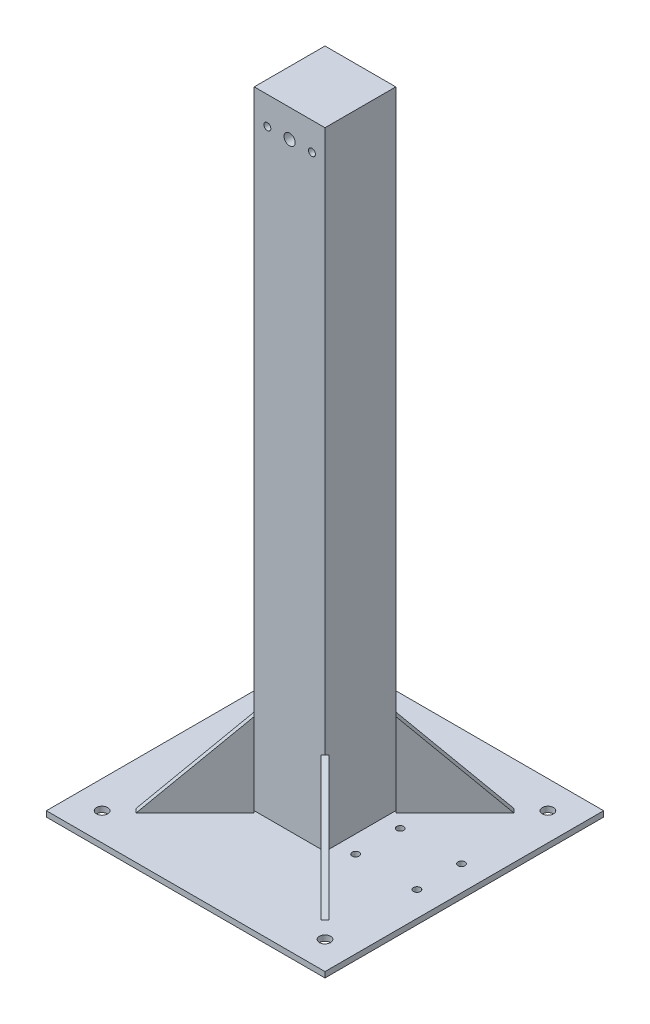
from build123d import *

# Parameters (mm, degrees)
ESBO_O1_W                       = 200
ESBO_O1_H                       = 200
RESSALTO_EXTRUS_O2_DEPTH        = 4
ESBO_O2_W                       = 50.8
ESBO_O2_H                       = 50.8
RESSALTO_EXTRUS_O3_DEPTH        = 450
ESBO_O3_R                       = 4
CORTE_EXTRUS_O1_DEPTH           = 4
CORTE_EXTRUS_O2_DEPTH           = 25.4
CORTE_EXTRUS_O2_DEPTH_BACK      = 25.4
ESBO_O5_R                       = 4
ESBO_O5_R_2                     = 2.5
ESBO_O6_R                       = 2.5
CORTE_EXTRUS_O3_DEPTH           = 4
RESSALTO_EXTRUS_O7_DEPTH        = 2
RESSALTO_EXTRUS_O7_DEPTH_BACK   = 2
RESSALTO_EXTRUS_O7_2_DEPTH      = 2
RESSALTO_EXTRUS_O7_2_DEPTH_BACK = 2
RESSALTO_EXTRUS_O8_DEPTH        = 2
RESSALTO_EXTRUS_O8_DEPTH_BACK   = 2
RESSALTO_EXTRUS_O8_2_DEPTH      = 2
RESSALTO_EXTRUS_O8_2_DEPTH_BACK = 2


with BuildPart() as part:
    # Esboço1 → Ressalto-extrusão2 (new body)
    with BuildSketch(Plane(origin=(0, 0, 0), x_dir=(1, 0, 0), z_dir=(0, 1, 0))):
        Rectangle(ESBO_O1_W, ESBO_O1_H)
    extrude(amount=-RESSALTO_EXTRUS_O2_DEPTH)

    # Esboço2 → Ressalto-extrusão3 (add)
    with BuildSketch(Plane(origin=(0, 0, 0), x_dir=(1, 0, 0), z_dir=(0, 1, 0))):
        Rectangle(ESBO_O2_W, ESBO_O2_H)
    extrude(amount=RESSALTO_EXTRUS_O3_DEPTH)

    # Esboço3 → Corte-extrusão1 (cut)
    with BuildSketch(Plane(origin=(0, 0, 0), x_dir=(1, 0, 0), z_dir=(0, 1, 0))):
        with Locations((80, -80)):
            Circle(ESBO_O3_R)
        with Locations((80, 80)):
            Circle(ESBO_O3_R)
        with Locations((-80, 80)):
            Circle(ESBO_O3_R)
        with Locations((-80, -80)):
            Circle(ESBO_O3_R)
    extrude(amount=-CORTE_EXTRUS_O1_DEPTH, mode=Mode.SUBTRACT)

    # Esboço5 → Corte-extrusão2 (cut, two sides: drawn at the far end of the back side and taken through both)
    with BuildSketch(Plane.XY.offset(-CORTE_EXTRUS_O2_DEPTH_BACK)):
        with Locations((0, 430)):
            Circle(ESBO_O5_R)
        with Locations((16, 430)):
            Circle(ESBO_O5_R_2)
        with Locations((-16, 430)):
            Circle(ESBO_O5_R_2)
    extrude(amount=CORTE_EXTRUS_O2_DEPTH + CORTE_EXTRUS_O2_DEPTH_BACK, mode=Mode.SUBTRACT)

    # Esboço6 → Corte-extrusão3 (cut)
    with BuildSketch(Plane(origin=(0, 0, 0), x_dir=(1, 0, 0), z_dir=(0, 1, 0))):
        with Locations((82, 16)):
            Circle(ESBO_O6_R)
        with Locations((82, -16)):
            Circle(ESBO_O6_R)
        with Locations((38, 16)):
            Circle(ESBO_O6_R)
        with Locations((38, -16)):
            Circle(ESBO_O6_R)
    extrude(amount=-CORTE_EXTRUS_O3_DEPTH, mode=Mode.SUBTRACT)


with BuildPart() as body_2:
    # Esboço8 → Ressalto-extrusão7 (new, two sides: drawn at the far end of the back side and taken through both)
    with BuildSketch(Plane(origin=(0, 0, 0), x_dir=(-0.7071067811865476, 0, -0.7071067811865476), z_dir=(0.7071067811865476, 0, -0.7071067811865476)).offset(-RESSALTO_EXTRUS_O7_DEPTH_BACK)):
        Polygon((35.92102448, 0), (95.92102448, 0), (35.92102448, 60), align=None)
    extrude(amount=RESSALTO_EXTRUS_O7_DEPTH + RESSALTO_EXTRUS_O7_DEPTH_BACK)


with BuildPart() as body_3:
    # Esboço8 → Ressalto-extrus_o7 2 (new, two sides: drawn at the far end of the back side and taken through both)
    with BuildSketch(Plane(origin=(0, 0, 0), x_dir=(-0.7071067811865476, 0, -0.7071067811865476), z_dir=(0.7071067811865476, 0, -0.7071067811865476)).offset(-RESSALTO_EXTRUS_O7_2_DEPTH_BACK)):
        Polygon((-35.92102448, 0), (-95.92102448, 0), (-35.92102448, 60), align=None)
    extrude(amount=RESSALTO_EXTRUS_O7_2_DEPTH + RESSALTO_EXTRUS_O7_2_DEPTH_BACK)


with BuildPart() as body_4:
    # Esboço10 → Ressalto-extrusão8 (new, two sides: drawn at the far end of the back side and taken through both)
    with BuildSketch(Plane(origin=(0, 0, 0), x_dir=(-0.7071067811865476, 0, 0.7071067811865476), z_dir=(-0.7071067811865476, 0, -0.7071067811865476)).offset(-RESSALTO_EXTRUS_O8_DEPTH_BACK)):
        Polygon((35.92102448, 0), (95.92102448, 0), (35.92102448, 60), align=None)
    extrude(amount=RESSALTO_EXTRUS_O8_DEPTH + RESSALTO_EXTRUS_O8_DEPTH_BACK)


with BuildPart() as body_5:
    # Esboço10 → Ressalto-extrus_o8 2 (new, two sides: drawn at the far end of the back side and taken through both)
    with BuildSketch(Plane(origin=(0, 0, 0), x_dir=(-0.7071067811865476, 0, 0.7071067811865476), z_dir=(-0.7071067811865476, 0, -0.7071067811865476)).offset(-RESSALTO_EXTRUS_O8_2_DEPTH_BACK)):
        Polygon((-35.92102448, 0), (-95.92102448, 0), (-35.92102448, 60), align=None)
    extrude(amount=RESSALTO_EXTRUS_O8_2_DEPTH + RESSALTO_EXTRUS_O8_2_DEPTH_BACK)


solid = Compound([part.part, body_2.part, body_3.part, body_4.part, body_5.part])
